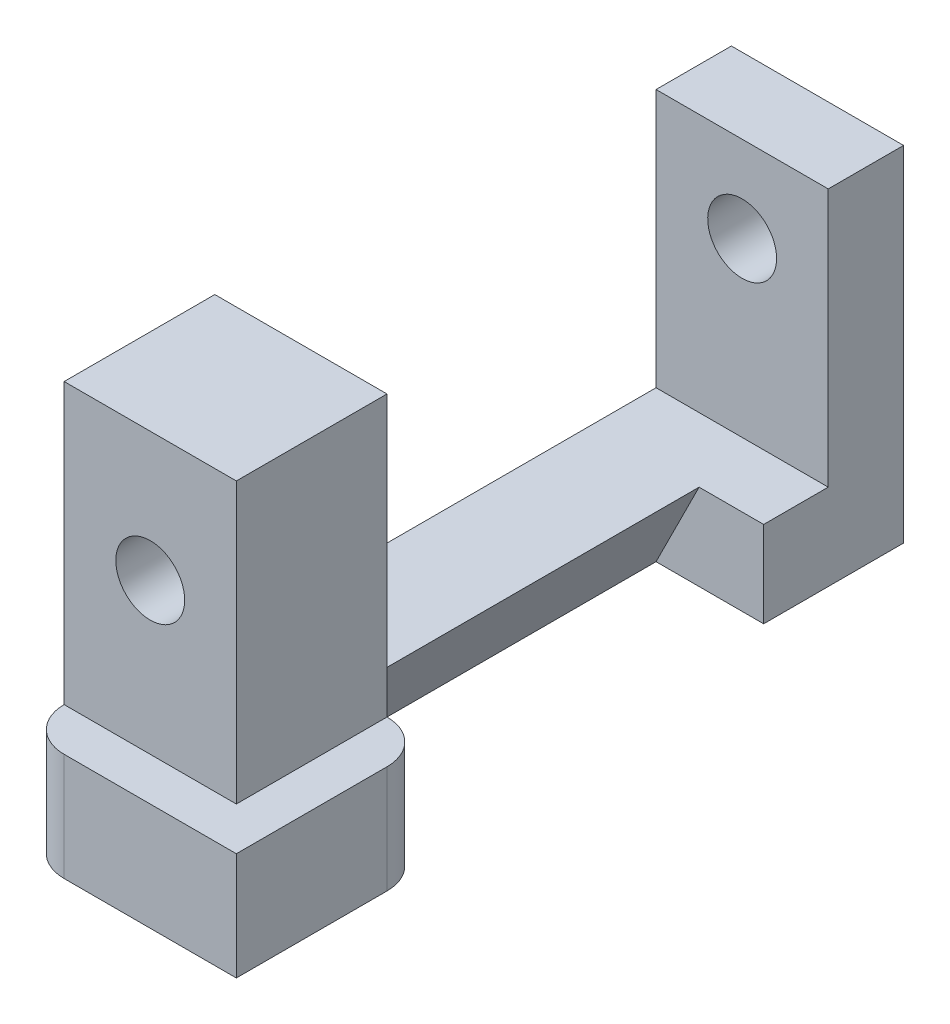
from build123d import *

# Parameters (mm, degrees)
BOSS_EXTRUDE1_DEPTH = 8
CUT_EXTRUDE2_DEPTH  = 20.5
SKETCH6_W           = 35.270415117
SKETCH6_H           = 22.226622545
CUT_EXTRUDE3_DEPTH  = 8
BOSS_EXTRUDE2_DEPTH = 3
BOSS_EXTRUDE7_DEPTH = 5
SKETCH7_R           = 1.6
CUT_EXTRUDE6_DEPTH  = 40.255572853


with BuildPart() as part:
    # Sketch1 → Boss-Extrude1 (new body)
    with BuildSketch(Plane(origin=(0, 0, 0), x_dir=(0, 0, -1), z_dir=(1, 0, 0))):
        Polygon((0, 0), (0, 16), (-3.5, 16), (-3.5, 4), (-24, 4), (-24, 18), (-31, 18), (-31, 0), align=None)
    boss_extrude1 = extrude(amount=-BOSS_EXTRUDE1_DEPTH)

    # Sketch5 → Cut-Extrude2 (cut)
    with BuildSketch(Plane.XY.offset(3.5)):
        Polygon((-8, 0), (-3, 0), (-5, 4), (-8, 4), align=None)
    cut_extrude2 = extrude(amount=CUT_EXTRUDE2_DEPTH, mode=Mode.SUBTRACT)

    # Mirror1: Boss-Extrude1, Cut-Extrude2 across plane
    add(boss_extrude1.mirror(Plane(origin=(-8, 0, 0), x_dir=(0, 0, 1), z_dir=(1, 0, 0))))
    add(cut_extrude2.mirror(Plane(origin=(-8, 0, 0), x_dir=(0, 0, 1), z_dir=(1, 0, 0))), mode=Mode.SUBTRACT)

    # Sketch6 → Cut-Extrude3 (cut)
    with BuildSketch(Plane(origin=(0, 0, 0), x_dir=(0, 0, -1), z_dir=(1, 0, 0))):
        with Locations((-16.260875851, 8.713036563)):
            Rectangle(SKETCH6_W, SKETCH6_H)
    extrude(amount=-CUT_EXTRUDE3_DEPTH, mode=Mode.SUBTRACT)

    # Sketch9 → Boss-Extrude2 (add)
    with BuildSketch(Plane.XY.offset(3.5)):
        Polygon((-11, 4), (-13, 0), (-8, 0), (-8, 4), align=None)
    extrude(amount=BOSS_EXTRUDE2_DEPTH)

    # Sketch13 → Boss-Extrude7 (add)
    with BuildSketch(Plane.XZ):
        with BuildLine():
            Line((-14, 33), (-6, 33))
            Line((-6, 33), (-6, 26))
            ThreePointArc((-6, 26), (-6.585786438, 24.585786438), (-8, 24))
            Line((-8, 24), (-8, 31))
            Line((-8, 31), (-16, 31))
            ThreePointArc((-16, 31), (-15.414213562, 32.414213562), (-14, 33))
        make_face()
    extrude(amount=-BOSS_EXTRUDE7_DEPTH)

    # Sketch7 → Cut-Extrude6 (cut, through all)
    with BuildSketch(Plane.XY.offset(31)):
        with Locations((-12, 12)):
            Circle(SKETCH7_R)
    extrude(amount=-CUT_EXTRUDE6_DEPTH, mode=Mode.SUBTRACT)


solid = part.part
